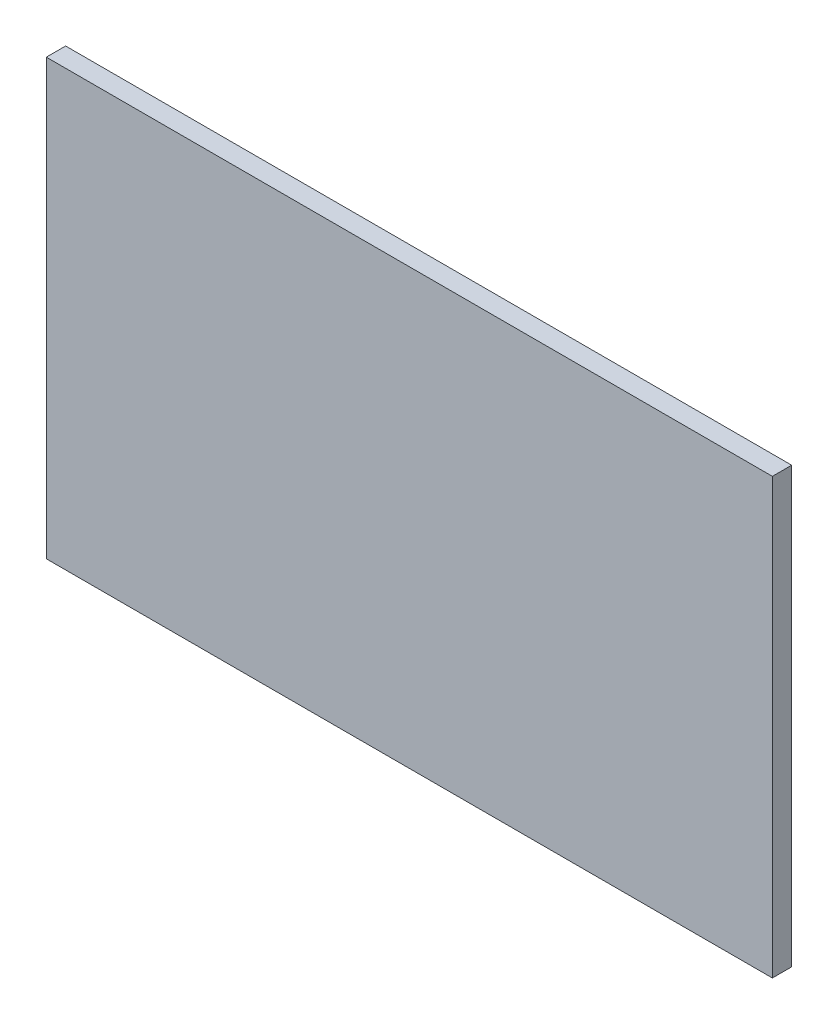
from build123d import *

# Parameters (mm, degrees)
SKETCH_2_W      = 376
SKETCH_2_H      = 225
EXTRUDE_1_DEPTH = 10


with BuildPart() as part:
    # Эскиз2 → Бобышка-Вытянуть1 (new body)
    with BuildSketch(Plane.XY):
        with Locations((0, -72.980568934)):
            Rectangle(SKETCH_2_W, SKETCH_2_H)
    extrude(amount=-EXTRUDE_1_DEPTH)


solid = part.part
